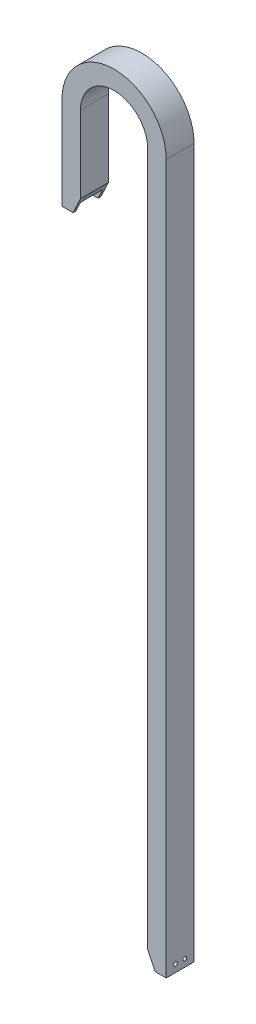
from build123d import *

# Parameters (mm, degrees)
EXTRUDE_1_DEPTH     = 15
SHELL_1_T           = -3
CUT_EXTRUDE_1_DEPTH = 676.11573082
SKETCH_4_R          = 2.1
CUT_EXTRUDE_2_DEPTH = 675.121836169
SKETCH_5_R          = 2.1
CUT_EXTRUDE_3_DEPTH = 3


with BuildPart() as part:
    # 草图1 → 凸台-拉伸1 (new, symmetric)
    with BuildSketch(Plane.XY):
        with BuildLine():
            Line((0, 0), (0, 100))
            ThreePointArc((0, 100), (56.25, 156.25), (112.5, 100))
            Line((112.5, 100), (112.5, -665))
            Line((112.5, -665), (92.5, -665))
            Line((92.5, -665), (92.5, 100))
            ThreePointArc((92.5, 100), (56.25, 136.25), (20, 100))
            Line((20, 100), (20, 0))
            Line((20, 0), (0, 0))
        make_face()
    extrude(amount=EXTRUDE_1_DEPTH, both=True)

    # 抽壳1
    shell_1_openings = [part.faces().sort_by_distance(p)[0] for p in [
        (102.5, -665, 0),
        (10, 0, 0),
    ]]
    offset(amount=SHELL_1_T, openings=shell_1_openings, kind=Kind.INTERSECTION)

    # 草图3 → 切除-拉伸1 (cut, through all)
    with BuildSketch(Plane.XY.offset(15)):
        Polygon((12, 0), (20, 17), (20, 0), align=None)
        Polygon((92.5, -665), (92.5, -648), (100.5, -665), align=None)
    extrude(amount=-CUT_EXTRUDE_1_DEPTH, mode=Mode.SUBTRACT)

    # 草图4 → 切除-拉伸2 (cut, through all)
    with BuildSketch(Plane.ZY.offset(-109.5)):
        with Locations(Location((-5, -657, 0), (0, 0, 270))):
            Circle(SKETCH_4_R)
        with Locations(Location((5, -657, 0), (0, 0, 270))):
            Circle(SKETCH_4_R)
    extrude(amount=-CUT_EXTRUDE_2_DEPTH, mode=Mode.SUBTRACT)

    # 草图5 → 切除-拉伸3 (cut)
    with BuildSketch(Plane.ZY):
        with Locations((-5, 8)):
            Circle(SKETCH_5_R)
        with Locations((5, 8)):
            Circle(SKETCH_5_R)
    extrude(amount=-CUT_EXTRUDE_3_DEPTH, mode=Mode.SUBTRACT)


solid = part.part
